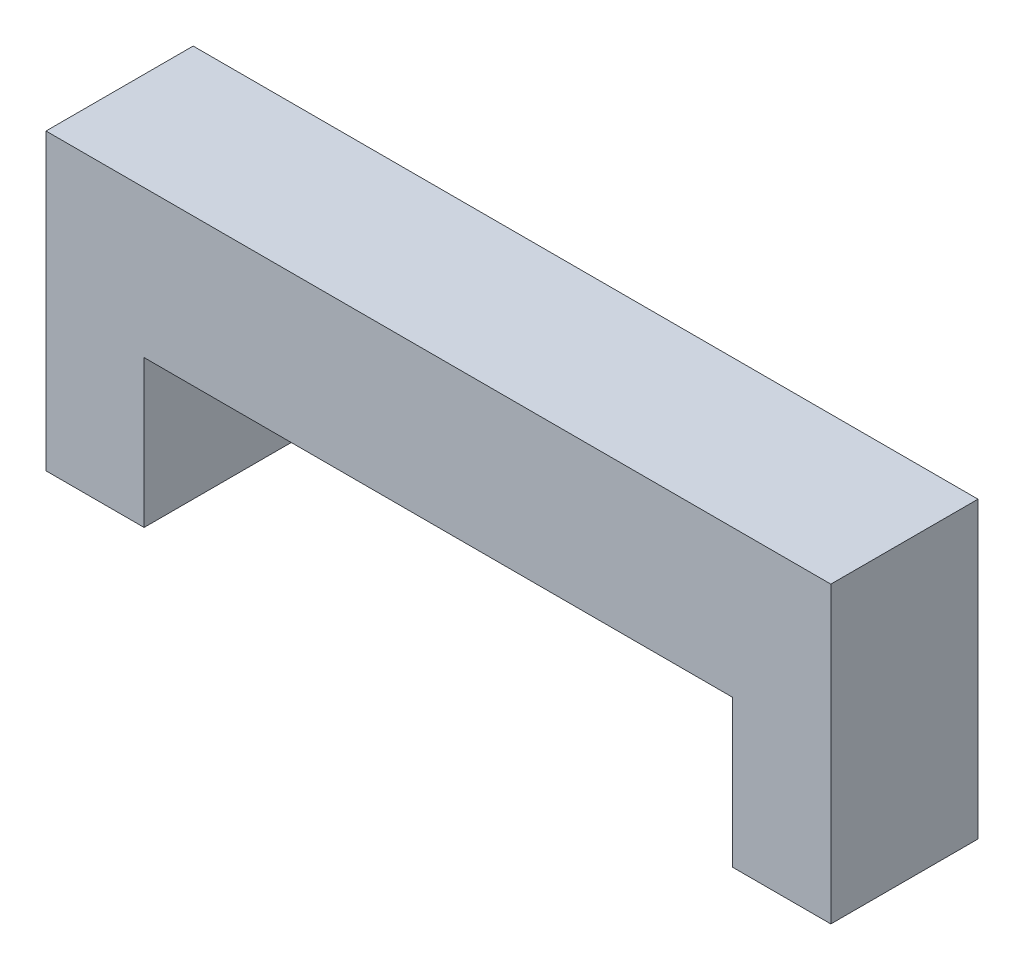
from build123d import *

# Parameters (mm, degrees)
BOSS_EXTRUDE1_DEPTH = 3


with BuildPart() as part:
    # Sketch1 → Boss-Extrude1 (new body)
    with BuildSketch(Plane.XY):
        Polygon((-22.68852459, 3.081967213), (-20.68852459, 3.081967213), (-20.68852459, 6.081967213), (-8.68852459, 6.081967213), (-8.68852459, 3.081967213), (-6.68852459, 3.081967213), (-6.68852459, 9.081967213), (-22.68852459, 9.081967213), align=None)
    extrude(amount=BOSS_EXTRUDE1_DEPTH)


solid = part.part
